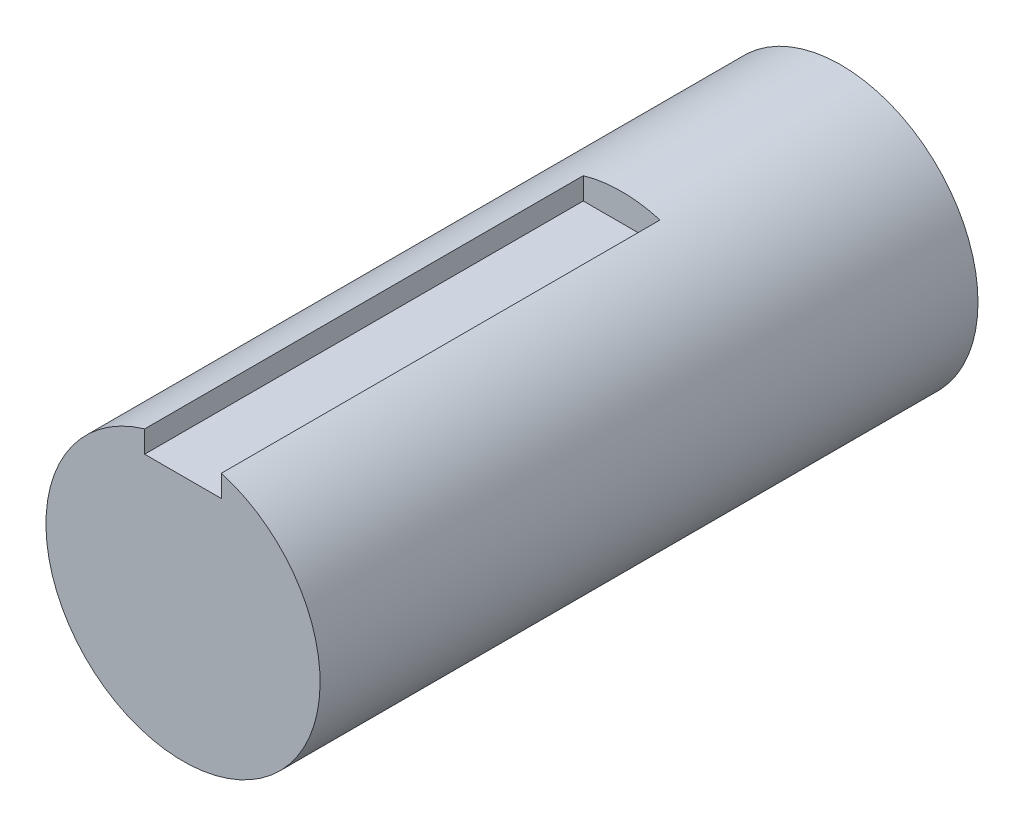
from build123d import *

# Parameters (mm, degrees)
SKETCH1_R           = 25
BOSS_EXTRUDE1_DEPTH = 60
SKETCH2_W           = 14
SKETCH2_H           = 10
CUT_EXTRUDE1_DEPTH  = 80


with BuildPart() as part:
    # Sketch1 → Boss-Extrude1 (new, symmetric)
    with BuildSketch(Plane.XY):
        Circle(SKETCH1_R)
    extrude(amount=BOSS_EXTRUDE1_DEPTH, both=True)

    # Sketch2 → Cut-Extrude1 (cut)
    with BuildSketch(Plane.XY.offset(60)):
        with Locations((0, 25)):
            Rectangle(SKETCH2_W, SKETCH2_H)
    extrude(amount=-CUT_EXTRUDE1_DEPTH, mode=Mode.SUBTRACT)


solid = part.part
